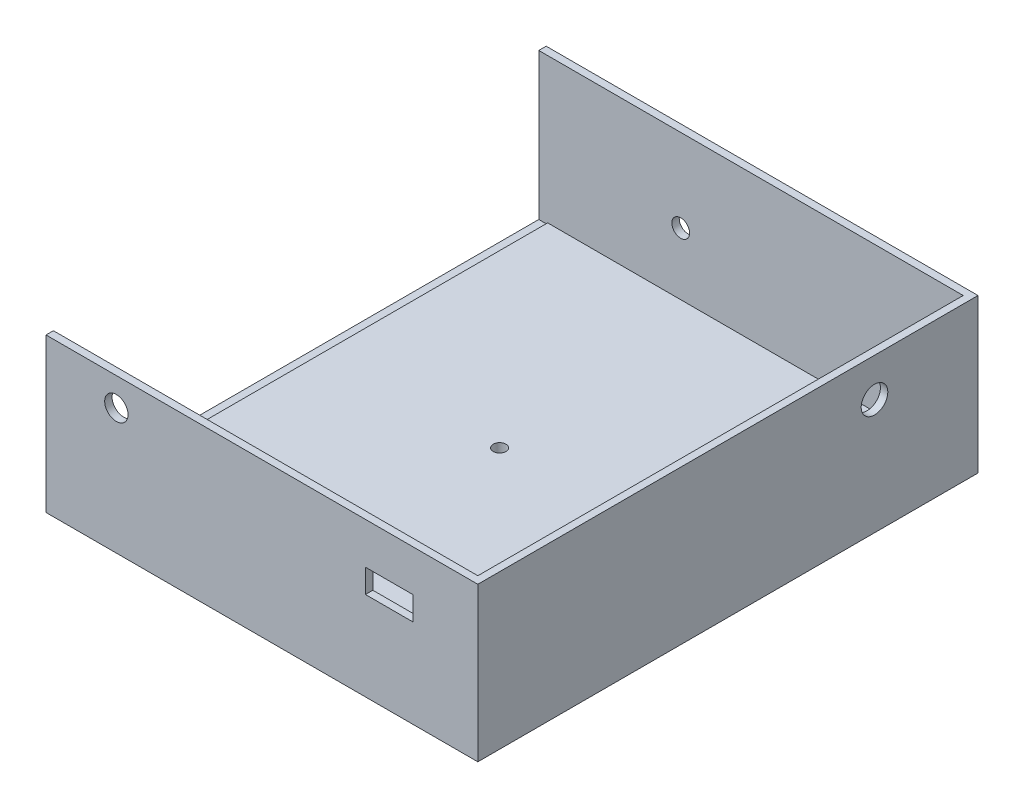
from build123d import *

# Parameters (mm, degrees)
SKETCH1_W           = 146.03
SKETCH1_H           = 169.14
BOSS_EXTRUDE2_DEPTH = 52
SKETCH6_W           = 141.03
SKETCH6_H           = 164.14
CUT_EXTRUDE3_DEPTH  = 49
SKETCH7_R           = 2.16
CUT_EXTRUDE4_DEPTH  = 50
SKETCH8_R           = 4.5
CUT_EXTRUDE5_DEPTH  = 2.5
SKETCH9_W           = 16
SKETCH9_H           = 8
CUT_EXTRUDE6_DEPTH  = 3
SKETCH12_W          = 164.14
SKETCH12_H          = 49.5
CUT_EXTRUDE9_DEPTH  = 3
SKETCH13_R          = 3.95
CUT_EXTRUDE10_DEPTH = 3
SKETCH14_R          = 3
CUT_EXTRUDE11_DEPTH = 3


with BuildPart() as part:
    # Sketch1 → Boss-Extrude2 (new body)
    with BuildSketch(Plane(origin=(0, 0, 0), x_dir=(1, 0, 0), z_dir=(0, 1, 0))):
        with Locations((-17.115088028, 11.447931338)):
            Rectangle(SKETCH1_W, SKETCH1_H)
    extrude(amount=BOSS_EXTRUDE2_DEPTH)

    # Sketch6 → Cut-Extrude3 (cut)
    with BuildSketch(Plane(origin=(0, 52, 0), x_dir=(1, 0, 0), z_dir=(0, 1, 0))):
        with Locations((-17.115088028, 11.447931338)):
            Rectangle(SKETCH6_W, SKETCH6_H)
    extrude(amount=-CUT_EXTRUDE3_DEPTH, mode=Mode.SUBTRACT)

    # Sketch7 → Cut-Extrude4 (cut)
    with BuildSketch(Plane(origin=(0, 3, 0), x_dir=(1, 0, 0), z_dir=(0, 1, 0))):
        with Locations(Location((39.239911972, -56.462068662, 0), (0, 0, 270))):
            Circle(SKETCH7_R)
        with Locations(Location((39.239911972, 79.357931338, 0), (0, 0, 270))):
            Circle(SKETCH7_R)
        with Locations(Location((-29.370088028, 19.517931338, 0), (0, 0, 270))):
            Circle(SKETCH7_R)
    extrude(amount=-CUT_EXTRUDE4_DEPTH, mode=Mode.SUBTRACT)

    # Sketch8 → Cut-Extrude5 (cut)
    with BuildSketch(Plane(origin=(55.899911972, 0, 0), x_dir=(0, 0, -1), z_dir=(1, 0, 0))):
        with Locations((61.017931338, 39)):
            Circle(SKETCH8_R)
    extrude(amount=-CUT_EXTRUDE5_DEPTH, mode=Mode.SUBTRACT)

    # Sketch9 → Cut-Extrude6 (cut)
    with BuildSketch(Plane.XY.offset(73.122068662)):
        with Locations((25.899911972, 34)):
            Rectangle(SKETCH9_W, SKETCH9_H)
    extrude(amount=-CUT_EXTRUDE6_DEPTH, mode=Mode.SUBTRACT)

    # Sketch12 → Cut-Extrude9 (cut)
    with BuildSketch(Plane.ZY.offset(90.130088028)):
        with Locations((-11.447931338, 27.25)):
            Rectangle(SKETCH12_W, SKETCH12_H)
    extrude(amount=-CUT_EXTRUDE9_DEPTH, mode=Mode.SUBTRACT)

    # Sketch13 → Cut-Extrude10 (cut)
    with BuildSketch(Plane.XY.offset(73.122068662)):
        with Locations((-66.33891095, 42.5)):
            Circle(SKETCH13_R)
    extrude(amount=-CUT_EXTRUDE10_DEPTH, mode=Mode.SUBTRACT)

    # Sketch14 → Cut-Extrude11 (cut)
    with BuildSketch(Plane(origin=(0, 0, -96.017931338), x_dir=(-1, 0, 0), z_dir=(0, 0, -1))):
        with Locations((42.130088028, 24)):
            Circle(SKETCH14_R)
    extrude(amount=-CUT_EXTRUDE11_DEPTH, mode=Mode.SUBTRACT)


solid = part.part
